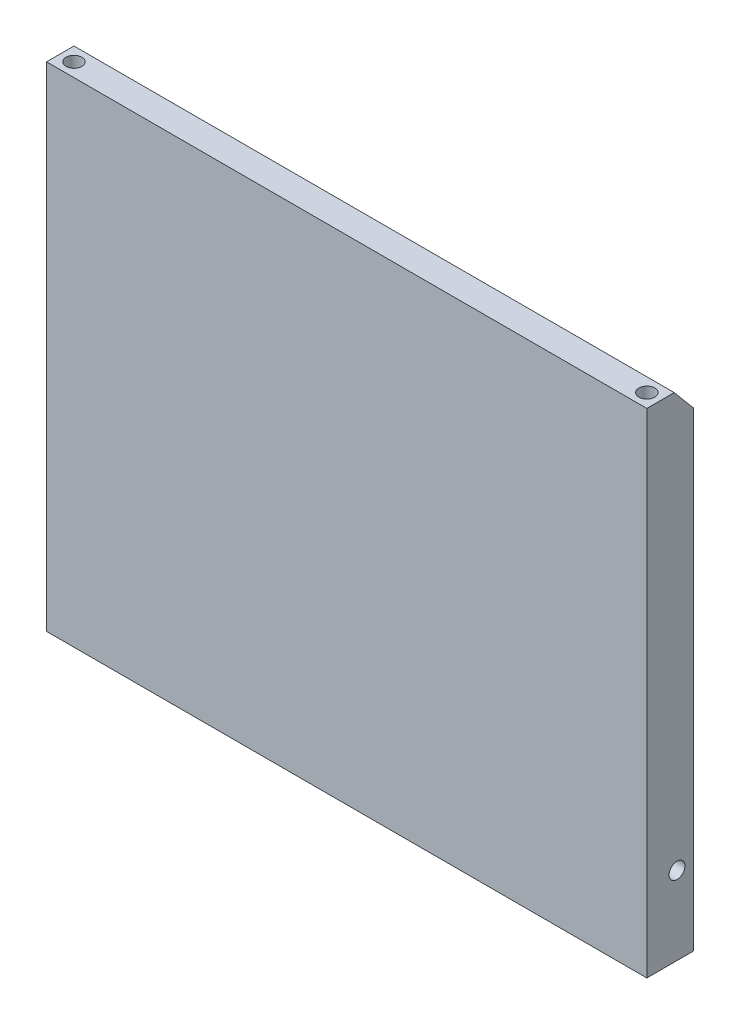
from build123d import *

# Parameters (mm, degrees)
SKETCH1_W           = 109.52
SKETCH1_H           = 90
BOSS_EXTRUDE1_DEPTH = 5
SKETCH2_R           = 1.45
CUT_EXTRUDE1_DEPTH  = 7
SKETCH4_W           = 109.52
SKETCH4_H           = 90
BOSS_EXTRUDE2_DEPTH = 3.5
CHAMFER1_SIZE       = 3.5
CHAMFER1_SIZE2      = 4.171137574
SKETCH5_W           = 100.2
SKETCH5_H           = 79.2
CUT_EXTRUDE3_DEPTH  = 6.5
SKETCH8_R           = 1.45
CUT_EXTRUDE5_DEPTH  = 3


with BuildPart() as part:
    # Sketch1 → Boss-Extrude1 (new body)
    with BuildSketch(Plane.XY):
        with Locations((49.453432203, -35.801949153)):
            Rectangle(SKETCH1_W, SKETCH1_H)
    extrude(amount=BOSS_EXTRUDE1_DEPTH)

    # Sketch2 → Cut-Extrude1 (cut)
    with BuildSketch(Plane(origin=(0, 9.198050847, 0), x_dir=(1, 0, 0), z_dir=(0, 1, 0))):
        with Locations(Location((-2.806567797, -2.5, 0), (0, 0, 270))):
            Circle(SKETCH2_R)
        with Locations(Location((101.713432203, -2.5, 0), (0, 0, 270))):
            Circle(SKETCH2_R)
    extrude(amount=-CUT_EXTRUDE1_DEPTH, mode=Mode.SUBTRACT)

    # Sketch4 → Boss-Extrude2 (add)
    with BuildSketch(Plane(origin=(0, 0, 0), x_dir=(-1, 0, 0), z_dir=(0, 0, -1))):
        with Locations((-49.453432203, -35.801949153)):
            Rectangle(SKETCH4_W, SKETCH4_H)
    extrude(amount=BOSS_EXTRUDE2_DEPTH)

    # Chamfer1
    chamfer1_edges = [part.edges().sort_by_distance(p)[0] for p in [
        (49.453432203, 9.198050847, -3.5),
    ]]
    chamfer1_side = [part.faces().sort_by_distance(p)[0] for p in [
        (49.453432203, 9.198050847, 0.724808812),
    ]]
    chamfer(chamfer1_edges, length=CHAMFER1_SIZE, length2=CHAMFER1_SIZE2, reference=chamfer1_side[0])

    # Sketch5 → Cut-Extrude3 (cut)
    with BuildSketch(Plane(origin=(0, 0, -3.5), x_dir=(-1, 0, 0), z_dir=(0, 0, -1))):
        with Locations((-49.453432203, -35.801949153)):
            Rectangle(SKETCH5_W, SKETCH5_H)
    extrude(amount=-CUT_EXTRUDE3_DEPTH, mode=Mode.SUBTRACT)

    # Sketch8 → Cut-Extrude5 (cut)
    with BuildSketch(Plane(origin=(104.213432203, 0, 0), x_dir=(0, 0, -1), z_dir=(1, 0, 0))):
        with Locations((0.5, -66.551949153)):
            Circle(SKETCH8_R)
    cut_extrude5 = extrude(amount=-CUT_EXTRUDE5_DEPTH, mode=Mode.SUBTRACT)

    # Mirror2: Cut-Extrude5 across plane
    add(cut_extrude5.mirror(Plane.ZY.offset(-49.453432203)), mode=Mode.SUBTRACT)


solid = part.part
